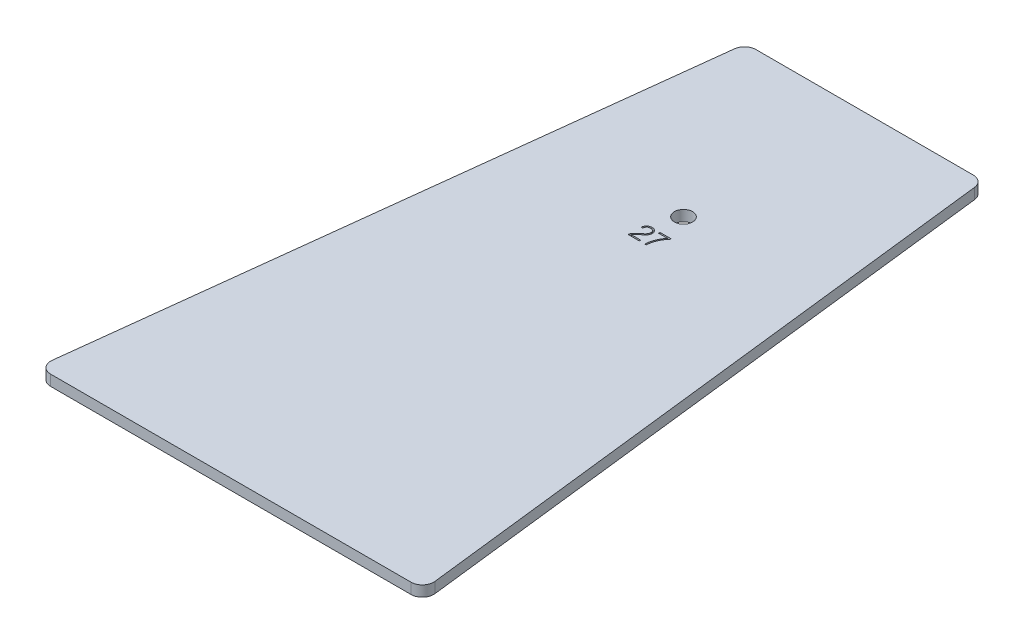
from build123d import *

# Parameters (mm, degrees)
BOSS_EXTRUDE1_DEPTH = 5.9944
SKETCH2_R           = 5.08
CUT_EXTRUDE1_DEPTH  = 372.756512027
CUT_EXTRUDE2_DEPTH  = 1.27
FILLET1_R           = 6.35


with BuildPart() as part:
    # Sketch1 → Boss-Extrude1 (new body)
    with BuildSketch(Plane(origin=(0, 0, 0), x_dir=(1, 0, 0), z_dir=(0, 1, 0))):
        Polygon((-66.675, 0), (66.675, 0), (108.238677943, -355.6), (-108.238677943, -355.6), align=None)
    extrude(amount=BOSS_EXTRUDE1_DEPTH)

    # Sketch2 → Cut-Extrude1 (cut, through all)
    with BuildSketch(Plane(origin=(0, 5.9944, 0), x_dir=(1, 0, 0), z_dir=(0, 1, 0))):
        with Locations(Location((0, -101.6, 0), (0, 0, 270))):
            Circle(SKETCH2_R)
    extrude(amount=-CUT_EXTRUDE1_DEPTH, mode=Mode.SUBTRACT)

    # Sketch3 → Cut-Extrude2 (cut)
    with BuildSketch(Plane(origin=(0, 5.9944, 0), x_dir=(1, 0, 0), z_dir=(0, 1, 0))):
        with BuildLine():
            Line((-0.64745098, -125.73), (-7.022352941, -125.73))
            add(Edge.make_bspline(
                [(-7.022352941, -125.73), (-6.995700037, -125.56647139), (-6.94264637, -125.240961184), (-6.822439521, -124.833851847), (-6.660985096, -124.502541973), (-6.475064564, -124.222842773), (-6.235482524, -123.909374898), (-5.933210944, -123.565961589), (-5.569119359, -123.193461978), (-5.137584514, -122.795086731), (-4.639123135, -122.372704423), (-4.278935295, -122.089977316), (-4.090147059, -121.941789216)],
                knots=[0, 0, 0, 0, 1.00794059, 2.006345856, 2.568221262, 3.244176762, 4.045978883, 4.967707078, 6.025786227, 7.214078669, 8.539791974, 10, 10, 10, 10], degree=3))
            add(Edge.make_bspline(
                [(-4.090147059, -121.941789216), (-3.959237505, -121.839291022), (-3.712095896, -121.645786669), (-3.367780634, -121.370812364), (-3.073520037, -121.12638684), (-2.749807849, -120.849934026), (-2.401956914, -120.521669006), (-2.050459284, -120.119964738), (-1.769921232, -119.720001197), (-1.574792785, -119.317093709), (-1.462696622, -118.90576348), (-1.450487068, -118.627391436), (-1.444313725, -118.486642157)],
                knots=[0, 0, 0, 0, 1.105083233, 2.086265203, 2.928643677, 3.647492745, 4.915719202, 6.103603942, 7.190110835, 8.152548768, 9.065899631, 10, 10, 10, 10], degree=3))
            add(Edge.make_bspline(
                [(-1.444313725, -118.486642157), (-1.447965678, -118.383696155), (-1.455062496, -118.183641793), (-1.508208178, -117.89411156), (-1.598896834, -117.626810225), (-1.725875028, -117.381877206), (-1.879897972, -117.157206868), (-2.067602091, -116.959226462), (-2.280144186, -116.783379567), (-2.521172126, -116.634524628), (-2.784585903, -116.511539466), (-3.072628503, -116.429562416), (-3.379272721, -116.373277743), (-3.591834853, -116.369040126), (-3.701053922, -116.366862745)],
                knots=[0, 0, 0, 0, 1.066440105, 2.072406788, 3.038089023, 3.980626898, 4.923164774, 5.851240192, 6.79842777, 7.774055624, 8.779619978, 9.800248095, 10.869719403, 12, 12, 12, 12], degree=3))
            add(Edge.make_bspline(
                [(-3.701053922, -116.366862745), (-3.856272912, -116.372784339), (-4.153856816, -116.384137145), (-4.575842478, -116.488503349), (-4.94872481, -116.662202163), (-5.273158686, -116.90555858), (-5.541086806, -117.223699711), (-5.760536331, -117.605911882), (-5.924737114, -118.058408876), (-5.991270058, -118.385922919), (-6.02627451, -118.558235294)],
                knots=[0, 0, 0, 0, 1.052503955, 2.0178474, 2.928593632, 3.828899676, 4.748107049, 5.732867451, 6.807211463, 8, 8, 8, 8], degree=3))
            Line((-6.02627451, -118.558235294), (-6.823137255, -118.43372549))
            add(Edge.make_bspline(
                [(-6.823137255, -118.43372549), (-6.80933515, -118.324490516), (-6.782336166, -118.110810556), (-6.71294302, -117.80167694), (-6.623223382, -117.510865089), (-6.510230906, -117.238067127), (-6.37723078, -116.983643092), (-6.222961391, -116.746154212), (-6.045126303, -116.528535029), (-5.846128896, -116.329076963), (-5.627309849, -116.151961167), (-5.393797446, -115.994859502), (-5.142464654, -115.86447923), (-4.877381927, -115.754431463), (-4.595667611, -115.670607699), (-4.298686261, -115.611680986), (-3.986147006, -115.577611658), (-3.772730074, -115.57257374), (-3.66370098, -115.57)],
                knots=[0, 0, 0, 0, 1.11558569, 2.182252598, 3.206865404, 4.197163727, 5.171016007, 6.113287932, 7.062752653, 8.014719109, 8.96418383, 9.912249364, 10.862587531, 11.829428462, 12.817713982, 13.836697005, 14.894825442, 16, 16, 16, 16], degree=3))
            add(Edge.make_bspline(
                [(-3.66370098, -115.57), (-3.556720592, -115.572319789), (-3.346239788, -115.576883907), (-3.037889894, -115.614942211), (-2.744018161, -115.6768103), (-2.465296832, -115.763662981), (-2.202890774, -115.877884746), (-1.951202346, -116.010088278), (-1.717482433, -116.17490368), (-1.497639325, -116.359297976), (-1.299748734, -116.564753592), (-1.122645846, -116.782681404), (-0.976555662, -117.018893798), (-0.853169483, -117.266964655), (-0.764695454, -117.53292748), (-0.694872253, -117.809240088), (-0.653577585, -118.101497133), (-0.649522593, -118.30078564), (-0.64745098, -118.402598039)],
                knots=[0, 0, 0, 0, 1.106681904, 2.177364475, 3.209175827, 4.210887483, 5.192078542, 6.167200624, 7.147039734, 8.145062256, 9.132109826, 10.094560107, 11.044836899, 12.000375742, 12.954465884, 13.938765234, 14.946957558, 16, 16, 16, 16], degree=3))
            add(Edge.make_bspline(
                [(-0.64745098, -118.402598039), (-0.651019305, -118.525228757), (-0.6580732, -118.767646194), (-0.715129167, -119.12624646), (-0.813824447, -119.47254261), (-0.943374808, -119.810657932), (-1.113892336, -120.134164725), (-1.314350095, -120.448008584), (-1.547654564, -120.749083332), (-1.770342076, -120.99003171), (-1.97351953, -121.182307301), (-2.148031694, -121.345116208), (-2.346754424, -121.522181935), (-2.570668292, -121.711175794), (-2.818646639, -121.913074715), (-3.084581883, -122.135434202), (-3.377659732, -122.368392422), (-3.582554579, -122.526226013), (-3.688602941, -122.607916667)],
                knots=[0, 0, 0, 0, 1.088993338, 2.152731221, 3.214950677, 4.282992305, 5.363056107, 6.45734114, 7.587448717, 8.741912054, 9.367708333, 10.072059012, 10.861970471, 11.731730561, 12.674646287, 13.702521352, 14.810883478, 16, 16, 16, 16], degree=3))
            add(Edge.make_bspline(
                [(-3.688602941, -122.607916667), (-3.814880187, -122.707673071), (-4.061272368, -122.90231778), (-4.409564614, -123.201952264), (-4.73097902, -123.495186281), (-5.017964452, -123.789920338), (-5.277411759, -124.07905832), (-5.50700849, -124.36473001), (-5.710619134, -124.64507084), (-5.822395863, -124.838757211), (-5.876862745, -124.933137255)],
                knots=[0, 0, 0, 0, 1.201760701, 2.344875646, 3.430713183, 4.449969728, 5.415927222, 6.330865599, 7.186659457, 8, 8, 8, 8], degree=3))
            Line((-5.876862745, -124.933137255), (-0.64745098, -124.933137255))
            Line((-0.64745098, -124.933137255), (-0.64745098, -125.73))
        make_face()
        with BuildLine():
            add(Edge.make_bspline(
                [(7.121960784, -116.348186275), (6.966339865, -116.529937257), (6.658951614, -116.888938584), (6.220934138, -117.43618394), (5.820990618, -117.99084912), (5.449181724, -118.546249507), (5.106128688, -119.103037308), (4.794532343, -119.662337897), (4.516462749, -120.225992354), (4.26698415, -120.792977059), (4.044548147, -121.3683878), (3.850270964, -121.955372575), (3.67057882, -122.552241729), (3.519790538, -123.16358515), (3.387268651, -123.786079212), (3.284032091, -124.423321677), (3.193868357, -125.071600422), (3.156448534, -125.509818618), (3.137647059, -125.73)],
                knots=[0, 0, 0, 0, 1.105388324, 2.183404297, 3.237157451, 4.263515625, 5.270618974, 6.257661546, 7.220201142, 8.173180298, 9.11857031, 10.06900231, 11.029056015, 11.99749775, 12.977109533, 13.9684726, 14.979265319, 16, 16, 16, 16], degree=3))
            Line((3.137647059, -125.73), (2.340784314, -125.73))
            add(Edge.make_bspline(
                [(2.340784314, -125.73), (2.370678975, -125.349642584), (2.429735016, -124.598257492), (2.61102689, -123.492894729), (2.858878127, -122.422284677), (3.182435664, -121.380929429), (3.581330157, -120.3591781), (3.949835575, -119.60787323), (4.230188707, -119.095806913), (4.404577952, -118.809755188), (4.594967573, -118.495142394), (4.815641098, -118.158570547), (5.057471949, -117.794755527), (5.324466786, -117.406124805), (5.619249624, -116.995425039), (5.821900516, -116.712397552), (5.926666667, -116.566078431)],
                knots=[0, 0, 0, 0, 1.601249526, 3.163222193, 4.697516546, 6.211791823, 7.737472103, 9.298034817, 9.721151344, 10.188082837, 10.704348124, 11.265001787, 11.877561367, 12.538519795, 13.244446179, 14, 14, 14, 14], degree=3))
            Line((5.926666667, -116.566078431), (0.94627451, -116.566078431))
            Line((0.94627451, -116.566078431), (0.94627451, -115.769215686))
            Line((0.94627451, -115.769215686), (7.121960784, -115.769215686))
            Line((7.121960784, -115.769215686), (7.121960784, -116.348186275))
        make_face()
    extrude(amount=-CUT_EXTRUDE2_DEPTH, mode=Mode.SUBTRACT)

    # Fillet1
    fillet1_edges = [part.edges().sort_by_distance(p)[0] for p in [
        (108.238677943, 2.9972, 355.6),
        (-108.238677943, 2.9972, 355.6),
        (-66.675, 2.9972, 0),
        (66.675, 2.9972, 0),
    ]]
    fillet(fillet1_edges, radius=FILLET1_R)


solid = part.part
